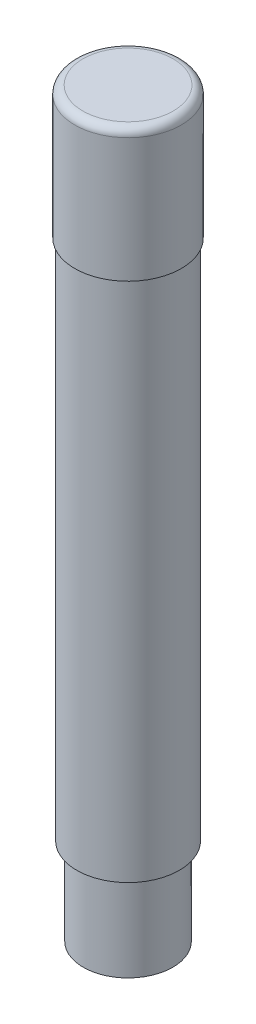
from build123d import *

# Parameters (mm, degrees)
FILLET1_R = 1


with BuildPart() as part:
    # Sketch2 → Revolve1 (revolve)
    with BuildSketch(Plane.XY, mode=Mode.PRIVATE) as revolve1_sk:
        Polygon((0, 0), (0, 91.9), (-6.6, 91.9), (-6.6, 75.5), (-6.35, 75.5), (-6.35, 10.8), (-5.55, 10.8), (-5.55, 0), align=None)
    revolve(revolve1_sk.sketch.rotate(Axis((0, 0, 0), (0, 1, 0)), 270), axis=Axis((0, 0, 0), (0, 1, 0)))

    # Fillet1
    fillet1_edges = [part.edges().sort_by_distance(p)[0] for p in [
        (0, 91.9, 6.6),
    ]]
    fillet(fillet1_edges, radius=FILLET1_R)


solid = part.part
